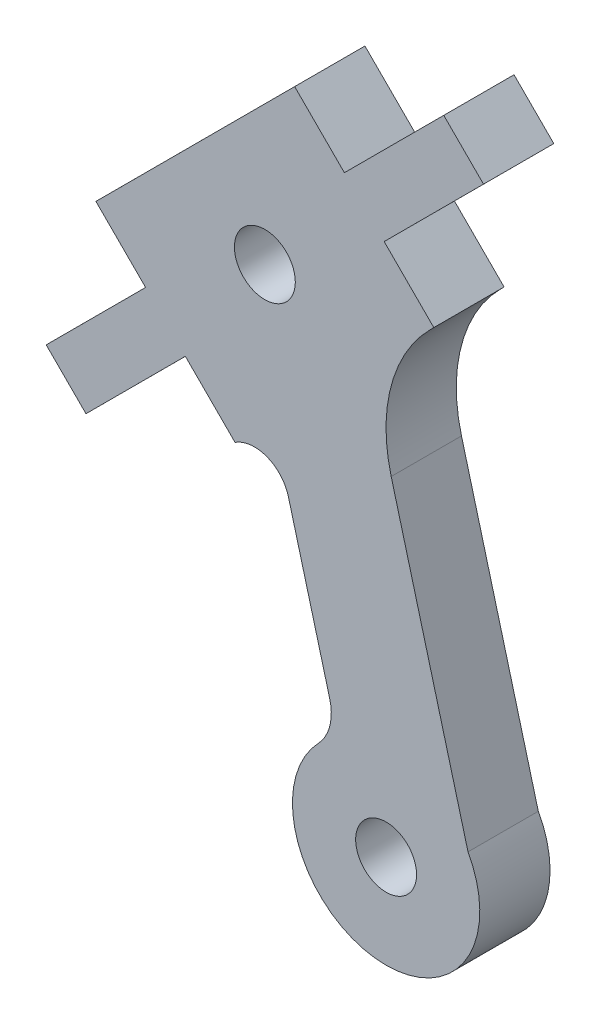
from build123d import *

# Parameters (mm, degrees)
SKETCH_1_R      = 1.3
EXTRUDE_1_DEPTH = 3


with BuildPart() as part:
    # 草图1 → 凸台-拉伸1 (new body)
    with BuildSketch(Plane(origin=(0, 0, -3.362857667), x_dir=(-1, 0, 0), z_dir=(0, 0, -1))):
        with BuildLine():
            Line((-8.929456987, 17.45330102), (-12.208534908, 5.216337034))
            ThreePointArc((-12.208534908, 5.216337034), (-8.203956956, -0.691485495), (-5.819308033, 6.03550946))
            ThreePointArc((-5.819308033, 6.03550946), (-6.310108859, 6.921233679), (-6.304159928, 7.933833034))
            Line((-6.304159928, 7.933833034), (-4.539684391, 14.518557193))
            ThreePointArc((-4.539684391, 14.518557193), (-3.62301138, 15.532716808), (-2.264294404, 15.382060533))
            Line((-2.264294404, 15.382060533), (-0.142530428, 17.503217343))
            Line((-0.142530428, 17.503217343), (4.099819599, 13.25965297))
            Line((4.099819599, 13.25965297), (5.797509256, 14.956856814))
            Line((5.797509256, 14.956856814), (1.554532399, 19.201048196))
            Line((1.554532399, 19.201048196), (3.675778765, 21.321687543))
            Line((3.675778765, 21.321687543), (-4.808443123, 29.808337985))
            Line((-4.808443123, 29.808337985), (-6.931968366, 27.685420414))
            Line((-6.931968366, 27.685420414), (-11.173246227, 31.927912314))
            Line((-11.173246227, 31.927912314), (-12.870428791, 30.231215419))
            Line((-12.870428791, 30.231215419), (-8.629080401, 25.98865297))
            Line((-8.629080401, 25.98865297), (-10.749072595, 23.869267436))
            Line((-10.749072595, 23.869267436), (-10.611098311, 23.731253658))
            ThreePointArc((-10.611098311, 23.731253658), (-8.929299443, 20.817545637), (-8.929456987, 17.45330102))
        make_face()
        with Locations(Location((-3.536567574, 22.593983824, 0), (0, 0, 180))):
            Circle(SKETCH_1_R, mode=Mode.SUBTRACT)
        with Locations(Location((-8.71249984, 3.274951558, 0), (0, 0, 180))):
            Circle(SKETCH_1_R, mode=Mode.SUBTRACT)
    extrude(amount=-EXTRUDE_1_DEPTH)


solid = part.part
